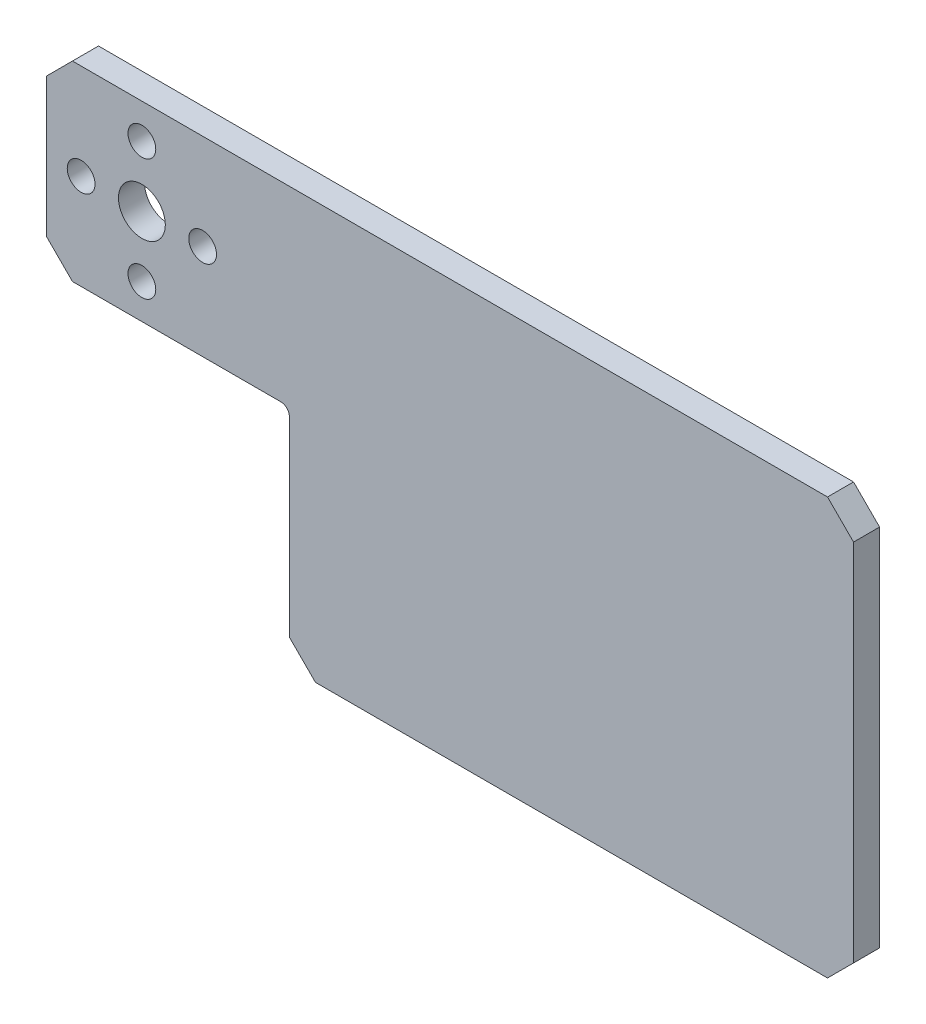
from build123d import *

# Parameters (mm, degrees)
SKETCH_1_W               = 93
SKETCH_1_H               = 48
EXTRUDE_1_DEPTH          = 3
SKETCH_2_R               = 2.7
SKETCH_2_R_2             = 1.6
CUT_EXTRUDE_1_DEPTH      = 53.414215629
PATTERN_CIRCULAR_1_COUNT = 4
SKETCH_3_W               = 28
SKETCH_3_H               = 26
CUT_EXTRUDE_2_DEPTH      = 53.414215629
FILLET_1_R               = 1
CHAMFER_1_SIZE           = 3


with BuildPart() as part:
    # 草圖1 → 填料-伸長1 (new body)
    with BuildSketch(Plane.XY):
        Rectangle(SKETCH_1_W, SKETCH_1_H)
    extrude(amount=EXTRUDE_1_DEPTH)

    # 草圖2 → 除料-伸長1 (cut, through all)
    with BuildSketch(Plane.XY.offset(3)):
        with Locations((-35.5, 13)):
            Circle(SKETCH_2_R)
        with Locations((-28.5, 13)):
            Circle(SKETCH_2_R_2)
    cut_extrude_1 = extrude(amount=-CUT_EXTRUDE_1_DEPTH, mode=Mode.SUBTRACT)

    # 環狀複製排列1: 除料-伸長1 ×4 about axis
    pattern_circular_1_axis = Axis((-35.5, 13, 0), (0, 0, 1))
    for i in range(1, PATTERN_CIRCULAR_1_COUNT):
        add(cut_extrude_1.rotate(pattern_circular_1_axis, i * 360 / PATTERN_CIRCULAR_1_COUNT), mode=Mode.SUBTRACT)

    # 草圖3 → 除料-伸長2 (cut, through all)
    with BuildSketch(Plane.XY.offset(3)):
        with Locations((-32.5, -11)):
            Rectangle(SKETCH_3_W, SKETCH_3_H)
    extrude(amount=-CUT_EXTRUDE_2_DEPTH, mode=Mode.SUBTRACT)

    # 圓角1
    fillet_1_edges = [part.edges().sort_by_distance(p)[0] for p in [
        (-18.5, 2, 1.5),
    ]]
    fillet(fillet_1_edges, radius=FILLET_1_R)

    # 導角1
    chamfer_1_edges = [part.edges().sort_by_distance(p)[0] for p in [
        (-46.5, 2, 1.5),
        (-18.5, -24, 1.5),
        (-46.5, 24, 1.5),
        (46.5, 24, 1.5),
        (46.5, -24, 1.5),
    ]]
    chamfer(chamfer_1_edges, length=CHAMFER_1_SIZE)


solid = part.part
